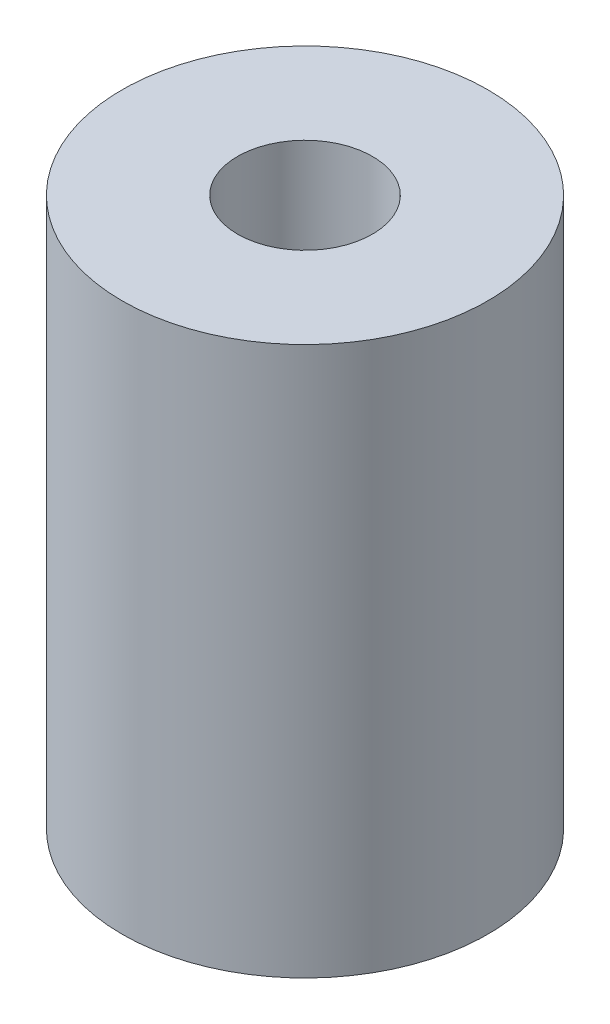
from build123d import *

# Parameters (mm, degrees)
SKETCH_1_R      = 4
SKETCH_1_R_2    = 1.475
EXTRUDE_1_DEPTH = 12


with BuildPart() as part:
    # 草图1 → 凸台-拉伸1 (new body)
    with BuildSketch(Plane(origin=(0, 0, 0), x_dir=(1, 0, 0), z_dir=(0, 1, 0))):
        with Locations(Location((0, 0, 0), (0, 0, 270))):
            Circle(SKETCH_1_R)
        with Locations(Location((0, 0, 0), (0, 0, 270))):
            Circle(SKETCH_1_R_2, mode=Mode.SUBTRACT)
    extrude(amount=EXTRUDE_1_DEPTH)


solid = part.part
